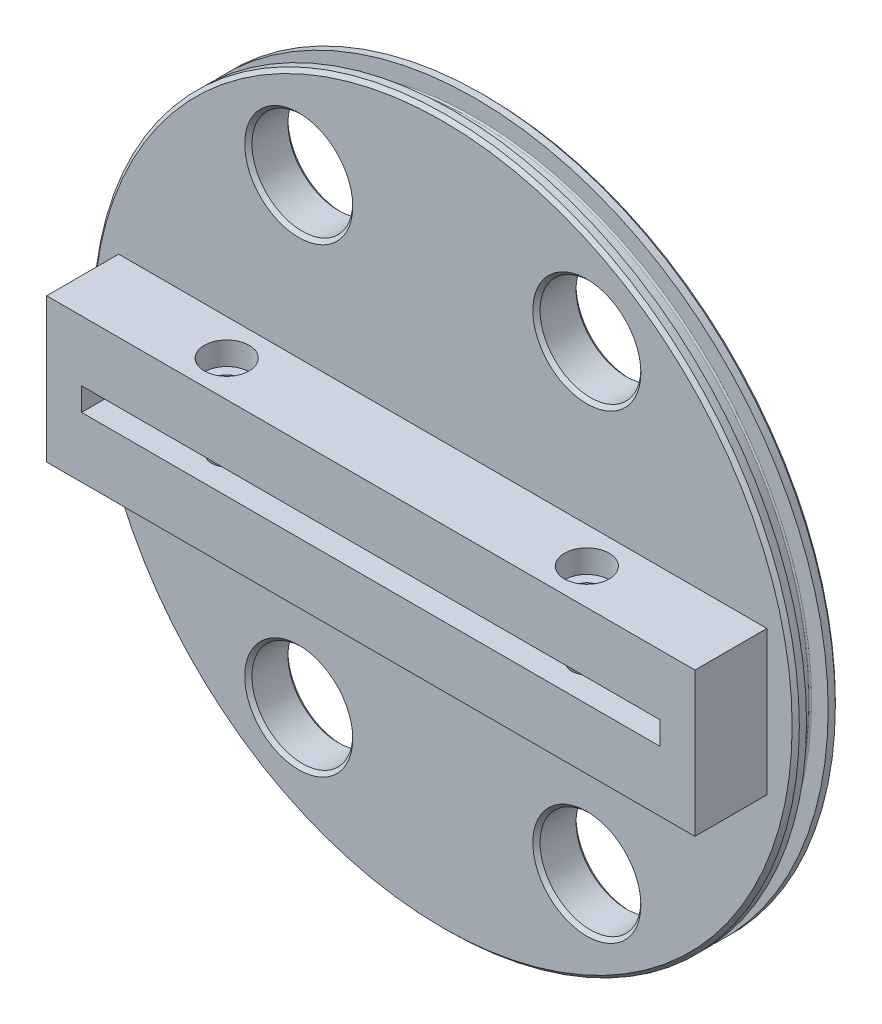
from build123d import *

# Parameters (mm, degrees)
SKETCH1_R                               = 49
DISC_PLATE_DEPTH                        = 6
SKETCH2_W                               = 90
SKETCH2_H                               = 20
BOSS_DEPTH                              = 10
SKETCH3_W                               = 80.3
SKETCH3_H                               = 3.2
SPINE_SLOT_DEPTH                        = 10
SKETCH4_W                               = 3
SKETCH4_H                               = 5.5
FILLET1_R                               = 0.2
CBORE_FOR_M5_HEX_HEAD_BOLT1_D           = 3.4
CBORE_FOR_M5_HEX_HEAD_BOLT1_DEPTH       = 8.4
CBORE_FOR_M5_HEX_HEAD_BOLT1_CBORE_D     = 6.2
CBORE_FOR_M5_HEX_HEAD_BOLT1_CBORE_DEPTH = 3.2
CBORE_FOR_M5_HEX_HEAD_BOLT1_TIP         = 1.021463052
SKETCH9_R                               = 2.1
INSERT_HOLES_DEPTH                      = 6.5
SKETCH10_R                              = 7
CABLE_HOLES_DEPTH                       = 72.119617547
CHAMFER1_SIZE                           = 0.5


with BuildPart() as part:
    # Sketch1 → Disc_Plate (new body)
    with BuildSketch(Plane.XY):
        Circle(SKETCH1_R)
    extrude(amount=DISC_PLATE_DEPTH)

    # Sketch2 → Boss (add)
    with BuildSketch(Plane.XY.offset(6)):
        Rectangle(SKETCH2_W, SKETCH2_H)
    extrude(amount=BOSS_DEPTH)

    # Sketch3 → Spine Slot (cut)
    with BuildSketch(Plane.XY.offset(16)):
        Rectangle(SKETCH3_W, SKETCH3_H)
    extrude(amount=-SPINE_SLOT_DEPTH, mode=Mode.SUBTRACT)

    # Sketch4 → Friction_Groove (revolve, cut)
    with BuildSketch(Plane(origin=(0, 0, 0), x_dir=(0, 0, -1), z_dir=(1, 0, 0))):
        with Locations((-3, 49.25)):
            Rectangle(SKETCH4_W, SKETCH4_H)
    revolve(axis=Axis((0, 0, 6), (0, 0, -1)), mode=Mode.SUBTRACT)

    # Fillet1
    fillet1_edges = [part.edges().sort_by_distance(p)[0] for p in [
        (0, -46.5, 1.5),
        (0, -46.5, 4.5),
    ]]
    fillet(fillet1_edges, radius=FILLET1_R)

    # CBORE for M5 Hex Head Bolt1
    with Locations(Plane(origin=(0, 10, 0), x_dir=(1, 0, 0), z_dir=(0, 1, 0))):
        with Locations((-25, -11), (25, -11), (11.381423857, 19.171145686)):
            CounterBoreHole(CBORE_FOR_M5_HEX_HEAD_BOLT1_D / 2, CBORE_FOR_M5_HEX_HEAD_BOLT1_CBORE_D / 2, CBORE_FOR_M5_HEX_HEAD_BOLT1_CBORE_DEPTH, depth=CBORE_FOR_M5_HEX_HEAD_BOLT1_DEPTH)
            with Locations((0, 0, -(CBORE_FOR_M5_HEX_HEAD_BOLT1_DEPTH + CBORE_FOR_M5_HEX_HEAD_BOLT1_TIP / 2))):  # 118° drill point
                Cone(0, CBORE_FOR_M5_HEX_HEAD_BOLT1_D / 2, CBORE_FOR_M5_HEX_HEAD_BOLT1_TIP, mode=Mode.SUBTRACT)

    # Sketch9 → Insert_Holes (cut)
    with BuildSketch(Plane(origin=(0, -1.6, 0), x_dir=(1, 0, 0), z_dir=(0, 1, 0))):
        with Locations((-25, -11)):
            Circle(SKETCH9_R)
        with Locations((25, -11)):
            Circle(SKETCH9_R)
    extrude(amount=-INSERT_HOLES_DEPTH, mode=Mode.SUBTRACT)

    # Sketch10 → Cable_Holes (cut, through all)
    with BuildSketch(Plane.XY):
        with Locations((20, 32)):
            Circle(SKETCH10_R)
        with Locations((20, -32)):
            Circle(SKETCH10_R)
        with Locations((-20, -32)):
            Circle(SKETCH10_R)
        with Locations((-20, 32)):
            Circle(SKETCH10_R)
    extrude(amount=CABLE_HOLES_DEPTH, mode=Mode.SUBTRACT)

    # Chamfer1
    chamfer1_edges = [part.edges().sort_by_distance(p)[0] for p in [
        (13, -32, 6),
        (13, -32, 0),
        (-27, -32, 0),
        (-27, -32, 6),
        (-27, 32, 0),
        (-27, 32, 6),
        (13, 32, 0),
        (13, 32, 6),
        (-49, 0, 0),
        (-49, 0, 6),
    ]]
    chamfer(chamfer1_edges, length=CHAMFER1_SIZE)


solid = part.part
